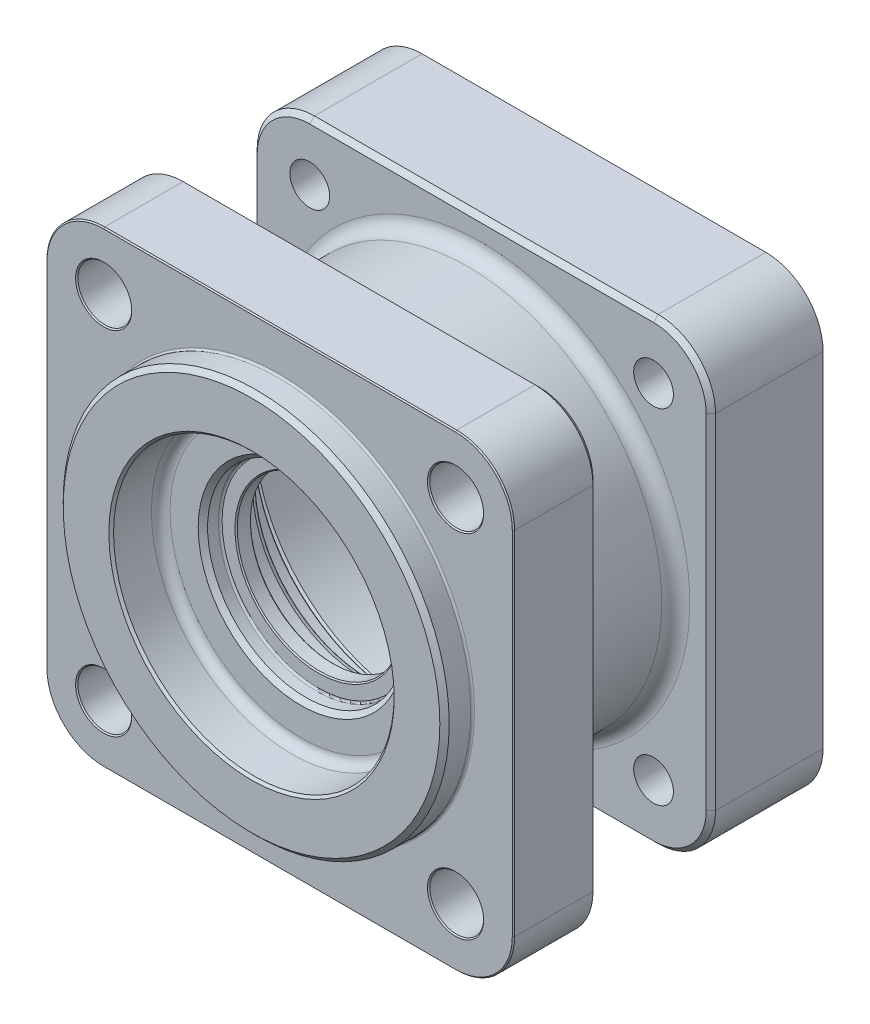
from build123d import *

# Parameters (mm, degrees)
SKETCH2_OUTSIDE_W  = 177.894
SKETCH2_OUTSIDE_H  = 177.894
SKETCH2_OUTSIDE_R  = 4.25
CUT_EXTRUDE1_DEPTH = 24
SKETCH3_OUTSIDE_W  = 177.894
SKETCH3_OUTSIDE_H  = 177.894
SKETCH3_OUTSIDE_R  = 5.75
CUT_EXTRUDE2_DEPTH = 18
SKETCH4_R          = 5.5
CUT_EXTRUDE3_DEPTH = 2
FILLET4_R          = 0.8
FILLET5_R          = 3
CHAMFER1_SIZE      = 1
CHAMFER2_SIZE      = 0.25


with BuildPart() as part:
    # Sketch1 → Revolve1 (revolve)
    with BuildSketch(Plane(origin=(0, 0, 0), x_dir=(0, 0, -1), z_dir=(1, 0, 0)), mode=Mode.PRIVATE) as revolve1_sk:
        with BuildLine():
            Line((0, 30.5), (0, 40.26))
            Line((0, 40.26), (1, 41.26))
            Line((1, 41.26), (5.6, 41.26))
            ThreePointArc((5.6, 41.26), (5.882842712, 41.377157288), (6, 41.66))
            Line((6, 41.66), (6, 67.5))
            Line((6, 67.5), (24, 67.5))
            Line((24, 67.5), (24, 41.5))
            Line((24, 41.5), (49.2, 41.5))
            Line((49.2, 41.5), (49.2, 67.5))
            Line((49.2, 67.5), (73.2, 67.5))
            Line((73.2, 67.5), (73.2, 37.375))
            Line((73.2, 37.375), (71.4, 37.375))
            ThreePointArc((71.4, 37.375), (71.046446609, 37.228553391), (70.9, 36.875))
            Line((70.9, 36.875), (70.9, 34.5))
            ThreePointArc((70.9, 34.5), (70.753553391, 34.146446609), (70.4, 34))
            Line((70.4, 34), (34.7, 34))
            Line((34.7, 34), (33.9, 34.461880215))
            ThreePointArc((33.9, 34.461880215), (33.1, 34.461880215), (32.7, 33.769059892))
            Line((32.7, 33.769059892), (32.7, 32.25))
            Line((32.7, 32.25), (32.45, 32))
            Line((32.45, 32), (26, 32))
            ThreePointArc((26, 32), (25.434314575, 31.765685425), (25.2, 31.2))
            Line((25.2, 31.2), (25.2, 24.651612686))
            ThreePointArc((25.2, 24.651612686), (25.09667667, 24.347231972), (24.829409523, 24.168649773))
            Line((24.829409523, 24.168649773), (24.2, 24))
            Line((24.2, 24), (18.4, 24))
            ThreePointArc((18.4, 24), (17.834314575, 23.765685425), (17.6, 23.2))
            Line((17.6, 23.2), (17.6, 17.85))
            Line((17.6, 17.85), (17.35, 17.6))
            Line((17.35, 17.6), (14.55, 17.6))
            Line((14.55, 17.6), (14.3, 17.85))
            Line((14.3, 17.85), (14.3, 20.6))
            ThreePointArc((14.3, 20.6), (14.182842712, 20.882842712), (13.9, 21))
            Line((13.9, 21), (11.6, 21))
            Line((11.6, 21), (10.6, 22))
            Line((10.6, 22), (10.6, 28))
            ThreePointArc((10.6, 28), (10.014213562, 29.414213562), (8.6, 30))
            Line((8.6, 30), (0.5, 30))
            Line((0.5, 30), (0, 30.5))
        make_face()
    revolve(revolve1_sk.sketch.rotate(Axis((0, 0, 0), (0, 0, -1)), 90), axis=Axis((0, 0, 0), (0, 0, -1)))

    # Sketch2 outside → Cut-Extrude1 (cut)
    # profile 1 of 5: a face of its own
    with BuildSketch(Plane(origin=(0, 0, -73.2), x_dir=(-1, 0, 0), z_dir=(0, 0, -1))):
        Rectangle(SKETCH2_OUTSIDE_W, SKETCH2_OUTSIDE_H)
        with BuildLine():
            Line((36.75, 49), (-36.75, 49))
            ThreePointArc((-36.75, 49), (-45.41205807, 45.41205807), (-49, 36.75))
            Line((-49, 36.75), (-49, -36.75))
            ThreePointArc((-49, -36.75), (-45.41205807, -45.41205807), (-36.75, -49))
            Line((-36.75, -49), (36.75, -49))
            ThreePointArc((36.75, -49), (45.41205807, -45.41205807), (49, -36.75))
            Line((49, -36.75), (49, 36.75))
            ThreePointArc((49, 36.75), (45.41205807, 45.41205807), (36.75, 49))
        make_face(mode=Mode.SUBTRACT)
    # profile 2 of 5: a face of its own
    with BuildSketch(Plane(origin=(0, 0, -73.2), x_dir=(-1, 0, 0), z_dir=(0, 0, -1))):
        with Locations((-36.75, 36.75)):
            Circle(SKETCH2_OUTSIDE_R)
    # profile 3 of 5: a face of its own
    with BuildSketch(Plane(origin=(0, 0, -73.2), x_dir=(-1, 0, 0), z_dir=(0, 0, -1))):
        with Locations((36.75, 36.75)):
            Circle(SKETCH2_OUTSIDE_R)
    # profile 4 of 5: a face of its own
    with BuildSketch(Plane(origin=(0, 0, -73.2), x_dir=(-1, 0, 0), z_dir=(0, 0, -1))):
        with Locations((36.75, -36.75)):
            Circle(SKETCH2_OUTSIDE_R)
    # profile 5 of 5: a face of its own
    with BuildSketch(Plane(origin=(0, 0, -73.2), x_dir=(-1, 0, 0), z_dir=(0, 0, -1))):
        with Locations((-36.75, -36.75)):
            Circle(SKETCH2_OUTSIDE_R)
    extrude(amount=-CUT_EXTRUDE1_DEPTH, mode=Mode.SUBTRACT)

    # Sketch3 outside → Cut-Extrude2 (cut)
    # profile 1 of 5: a face of its own
    with BuildSketch(Plane.XY.offset(-6)):
        Rectangle(SKETCH3_OUTSIDE_W, SKETCH3_OUTSIDE_H)
        with BuildLine():
            Line((-37.618080759, 50), (37.618080759, 50))
            ThreePointArc((37.618080759, 50), (46.373419818, 46.373419818), (50, 37.618080759))
            Line((50, 37.618080759), (50, -37.618080759))
            ThreePointArc((50, -37.618080759), (46.373419818, -46.373419818), (37.618080759, -50))
            Line((37.618080759, -50), (-37.618080759, -50))
            ThreePointArc((-37.618080759, -50), (-46.373419818, -46.373419818), (-50, -37.618080759))
            Line((-50, -37.618080759), (-50, 37.618080759))
            ThreePointArc((-50, 37.618080759), (-46.373419818, 46.373419818), (-37.618080759, 50))
        make_face(mode=Mode.SUBTRACT)
    # profile 2 of 5: a face of its own
    with BuildSketch(Plane.XY.offset(-6)):
        with Locations((37.618080759, 37.618080759)):
            Circle(SKETCH3_OUTSIDE_R)
    # profile 3 of 5: a face of its own
    with BuildSketch(Plane.XY.offset(-6)):
        with Locations((-37.618080759, 37.618080759)):
            Circle(SKETCH3_OUTSIDE_R)
    # profile 4 of 5: a face of its own
    with BuildSketch(Plane.XY.offset(-6)):
        with Locations((-37.618080759, -37.618080759)):
            Circle(SKETCH3_OUTSIDE_R)
    # profile 5 of 5: a face of its own
    with BuildSketch(Plane.XY.offset(-6)):
        with Locations((37.618080759, -37.618080759)):
            Circle(SKETCH3_OUTSIDE_R)
    extrude(amount=-CUT_EXTRUDE2_DEPTH, mode=Mode.SUBTRACT)

    # Sketch4 → Cut-Extrude3 (cut)
    with BuildSketch(Plane(origin=(0, 0, -73.2), x_dir=(-1, 0, 0), z_dir=(0, 0, -1))):
        with Locations((-36.75, 36.75)):
            Circle(SKETCH4_R)
        with Locations((36.75, 36.75)):
            Circle(SKETCH4_R)
        with Locations((-36.75, -36.75)):
            Circle(SKETCH4_R)
        with Locations((36.75, -36.75)):
            Circle(SKETCH4_R)
    extrude(amount=-CUT_EXTRUDE3_DEPTH, mode=Mode.SUBTRACT)

    # Fillet4
    fillet4_edges = [part.edges().sort_by_distance(p)[0] for p in [
        (-41.5, 0, -24),
    ]]
    fillet(fillet4_edges, radius=FILLET4_R)

    # Fillet5
    fillet5_edges = [part.edges().sort_by_distance(p)[0] for p in [
        (-41.5, 0, -49.2),
    ]]
    fillet(fillet5_edges, radius=FILLET5_R)

    # Chamfer1
    chamfer1_edges = [part.edges().sort_by_distance(p)[0] for p in [
        (0, 49, -49.2),
        (45.41205807, 45.41205807, -49.2),
        (49, 0, -49.2),
        (45.41205807, -45.41205807, -49.2),
        (0, -49, -49.2),
        (-45.41205807, -45.41205807, -49.2),
        (-49, 0, -49.2),
        (-45.41205807, 45.41205807, -49.2),
        (-50, 0, -24),
        (-46.373419818, -46.373419818, -24),
        (0, -50, -24),
        (46.373419818, -46.373419818, -24),
        (50, 0, -24),
        (46.373419818, 46.373419818, -24),
        (0, 50, -24),
        (-46.373419818, 46.373419818, -24),
    ]]
    chamfer(chamfer1_edges, length=CHAMFER1_SIZE)

    # Chamfer2
    chamfer2_edges = [part.edges().sort_by_distance(p)[0] for p in [
        (31.868080759, 37.618080759, -6),
        (-43.368080759, 37.618080759, -6),
        (-43.368080759, -37.618080759, -6),
        (31.868080759, -37.618080759, -6),
        (-50, 0, -6),
        (-46.373419818, -46.373419818, -6),
        (0, -50, -6),
        (46.373419818, -46.373419818, -6),
        (50, 0, -6),
        (46.373419818, 46.373419818, -6),
        (0, 50, -6),
        (-46.373419818, 46.373419818, -6),
    ]]
    chamfer(chamfer2_edges, length=CHAMFER2_SIZE)


solid = part.part
